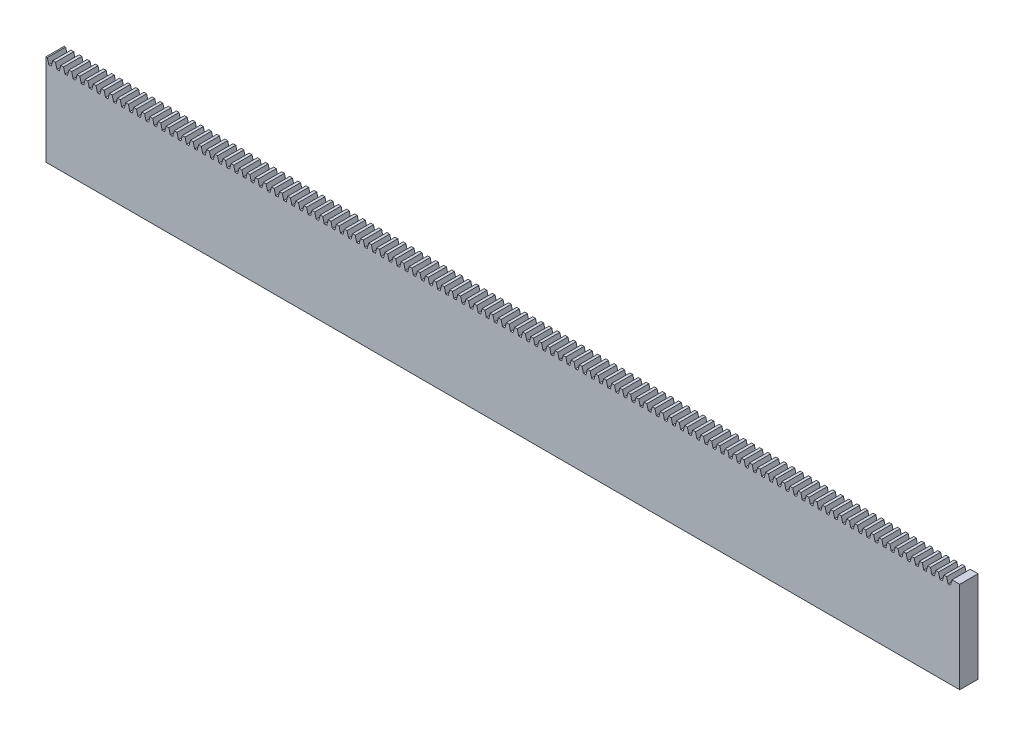
from build123d import *

# Parameters (mm, degrees)
SKETCH1_W           = 300
SKETCH1_H           = 30
BOSS_EXTRUDE1_DEPTH = 6
CUT_EXTRUDE2_DEPTH  = 7
LPATTERN1_COUNT     = 112
LPATTERN1_PITCH     = 2.65988178


with BuildPart() as part:
    # Sketch1 → Boss-Extrude1 (new body)
    with BuildSketch(Plane.XY):
        with Locations((150, 15)):
            Rectangle(SKETCH1_W, SKETCH1_H)
    extrude(amount=BOSS_EXTRUDE1_DEPTH)

    # Sketch2 → Cut-Extrude2 (cut, symmetric)
    with BuildSketch(Plane.XY):
        Polygon((0.918310507, 28.17374), (0.187389973, 31), (2.472491807, 31), (1.741571274, 28.17374), align=None)
    cut_extrude2 = extrude(amount=CUT_EXTRUDE2_DEPTH, both=True, mode=Mode.SUBTRACT)

    # LPattern1: Cut-Extrude2 ×112
    with Locations(*[(i * LPATTERN1_PITCH, 0, 0) for i in range(1, LPATTERN1_COUNT)]):
        add(cut_extrude2, mode=Mode.SUBTRACT)


solid = part.part
